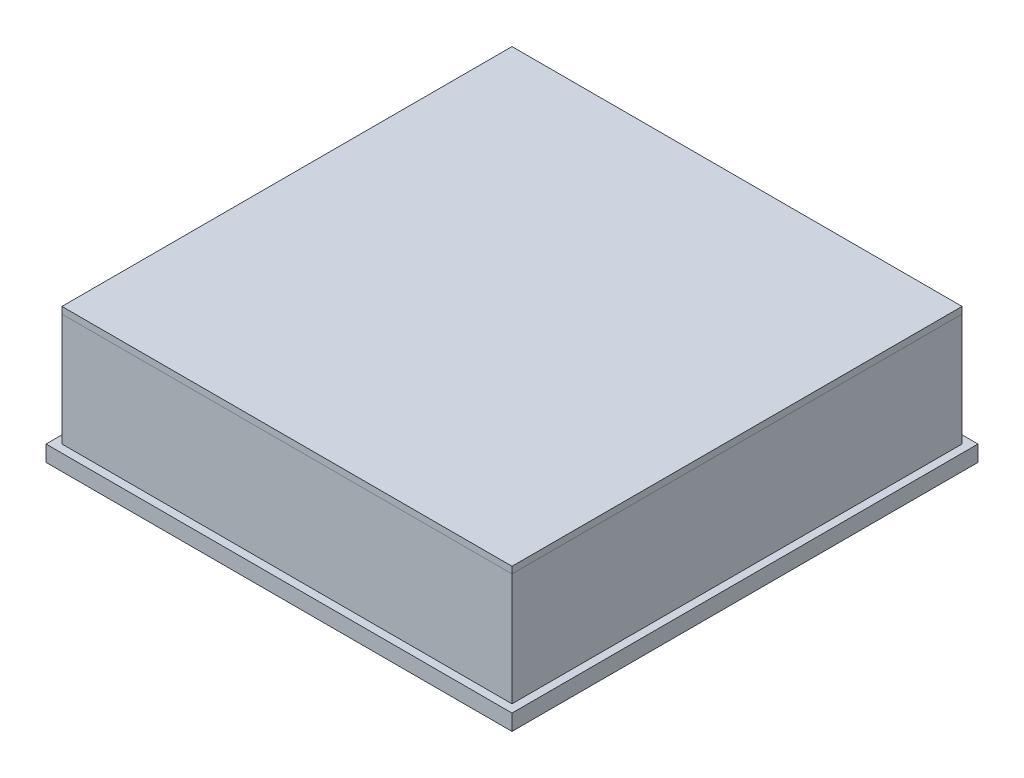
from build123d import *

# Parameters (mm, degrees)
SKETCH2_W           = 8609.584
SKETCH2_H           = 8609.584
SKETCH2_W_2         = 7999.984
SKETCH2_H_2         = 7999.984
BOSS_EXTRUDE1_DEPTH = 1999.996
SKETCH3_W           = 8609.584
SKETCH3_H           = 8609.584
BOSS_EXTRUDE2_DEPTH = 152.4
SKETCH4_W           = 8914.384
SKETCH4_H           = 8914.384
SKETCH4_W_2         = 7695.184
SKETCH4_H_2         = 7695.184
BOSS_EXTRUDE3_DEPTH = 304.8
SKETCH6_W           = 304.8
SKETCH6_H           = 304.8
BOSS_EXTRUDE5_DEPTH = 1999.996
SKETCH7_W           = 8609.584
SKETCH7_H           = 8609.584
BOSS_EXTRUDE6_DEPTH = 127


with BuildPart() as part:
    # Sketch2 → Boss-Extrude1 (new body)
    with BuildSketch(Plane(origin=(0, 0, 0), x_dir=(1, 0, 0), z_dir=(0, 1, 0))):
        Rectangle(SKETCH2_W, SKETCH2_H)
        Rectangle(SKETCH2_W_2, SKETCH2_H_2, mode=Mode.SUBTRACT)
    extrude(amount=BOSS_EXTRUDE1_DEPTH)

    # Sketch3 → Boss-Extrude2 (add)
    with BuildSketch(Plane.XZ):
        Rectangle(SKETCH3_W, SKETCH3_H)
    extrude(amount=BOSS_EXTRUDE2_DEPTH)

    # Sketch4 → Boss-Extrude3 (add)
    with BuildSketch(Plane.XZ.offset(152.4)):
        Rectangle(SKETCH4_W, SKETCH4_H)
        Rectangle(SKETCH4_W_2, SKETCH4_H_2, mode=Mode.SUBTRACT)
    extrude(amount=BOSS_EXTRUDE3_DEPTH)

    # Sketch6 → Boss-Extrude5 (add)
    with BuildSketch(Plane(origin=(0, 0, 0), x_dir=(1, 0, 0), z_dir=(0, 1, 0))):
        with Locations((1656.850935784, 1656.850935784)):
            Rectangle(SKETCH6_W, SKETCH6_H)
        with Locations((-1656.850935784, 1656.850935784)):
            Rectangle(SKETCH6_W, SKETCH6_H)
        with Locations((1656.850935784, -1656.850935784)):
            Rectangle(SKETCH6_W, SKETCH6_H)
        with Locations((-1656.850935784, -1656.850935784)):
            Rectangle(SKETCH6_W, SKETCH6_H)
    extrude(amount=BOSS_EXTRUDE5_DEPTH)


with BuildPart() as body_2:
    # Sketch7 → Boss-Extrude6 (new body)
    with BuildSketch(Plane(origin=(0, 1999.996, 0), x_dir=(1, 0, 0), z_dir=(0, 1, 0))):
        Rectangle(SKETCH7_W, SKETCH7_H)
    extrude(amount=BOSS_EXTRUDE6_DEPTH)


solid = Compound([part.part, body_2.part])
